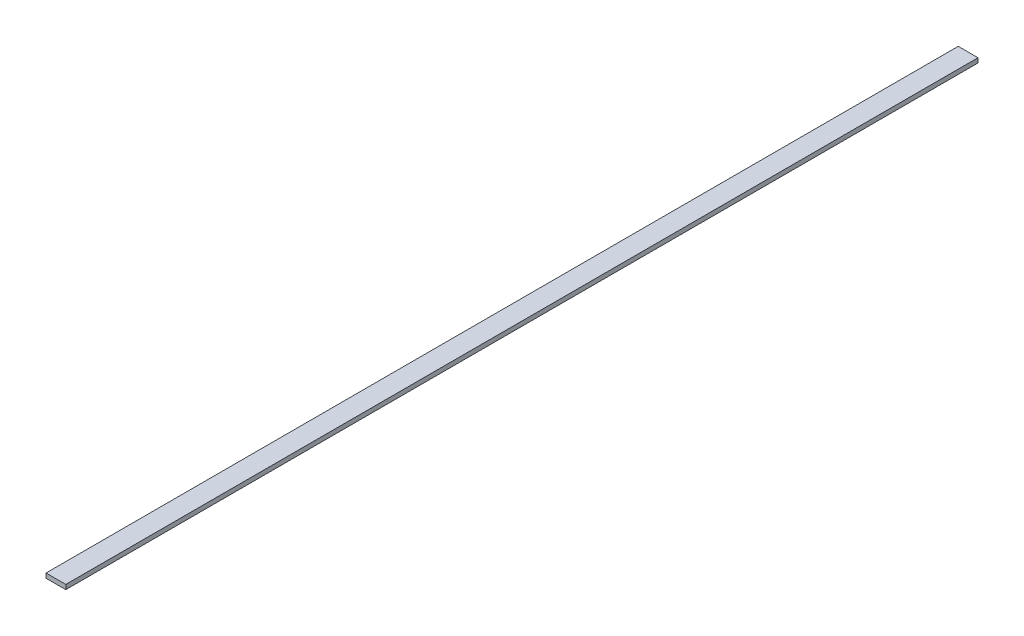
from build123d import *

# Parameters (mm, degrees)
ESBO_O1_W                = 6.5
ESBO_O1_H                = 1.5
RESSALTO_EXTRUS_O1_DEPTH = 300


with BuildPart() as part:
    # Esboço1 → Ressalto-extrusão1 (new body)
    with BuildSketch(Plane.XY):
        Rectangle(ESBO_O1_W, ESBO_O1_H)
    extrude(amount=RESSALTO_EXTRUS_O1_DEPTH)


solid = part.part
